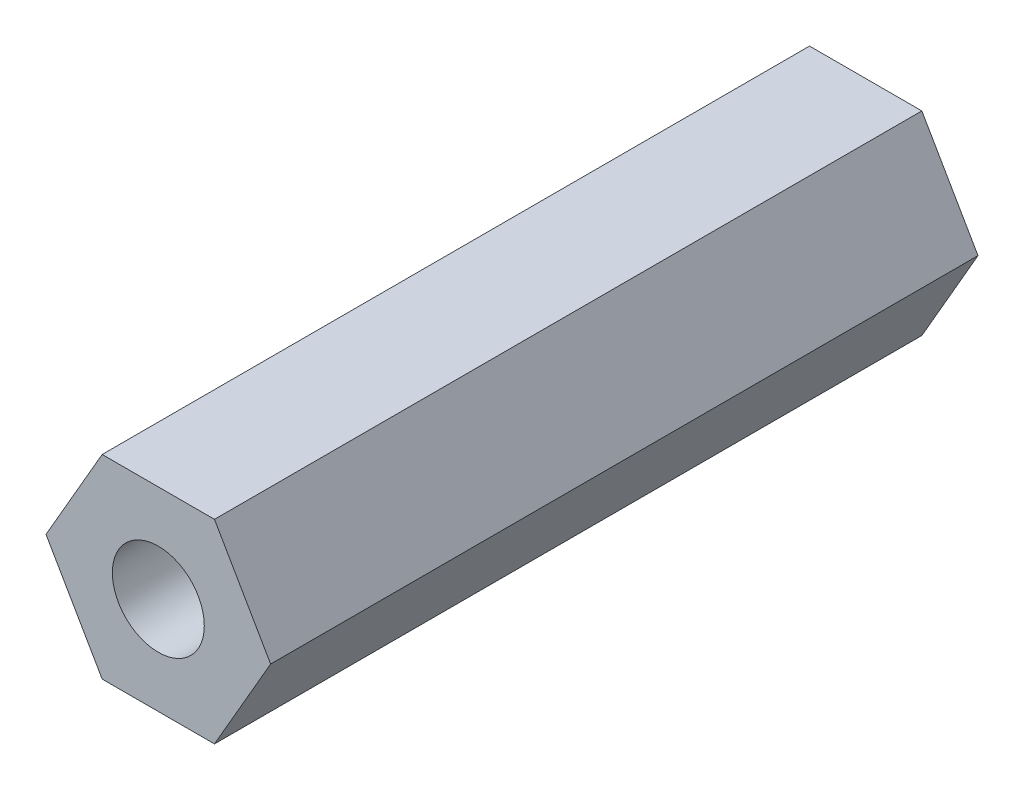
from build123d import *

# Parameters (mm, degrees)
SKETCH_1_R      = 1.3
EXTRUDE_1_DEPTH = 20


with BuildPart() as part:
    # 草图1 → 凸台-拉伸1 (new body)
    with BuildSketch(Plane.XY):
        Polygon((1.58771324, 2.75), (-1.58771324, 2.75), (-3.175426481, 0), (-1.58771324, -2.75), (1.58771324, -2.75), (3.175426481, 0), align=None)
        Circle(SKETCH_1_R, mode=Mode.SUBTRACT)
    extrude(amount=EXTRUDE_1_DEPTH)


solid = part.part
